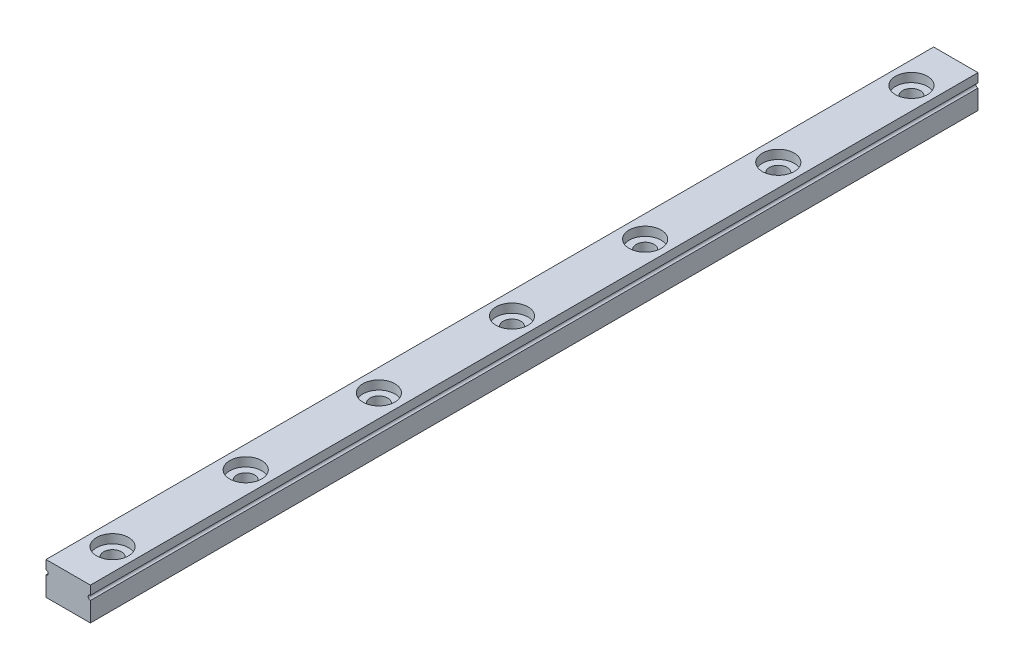
from build123d import *

# Parameters (mm, degrees)
BOSS_EXTRUDE1_DEPTH = 50
SKETCH2_R           = 1.8
CUT_EXTRUDE1_DEPTH  = 1
SKETCH3_R           = 1
CUT_EXTRUDE3_DEPTH  = 51.199003974
LPATTERN1_COUNT     = 7
LPATTERN1_PITCH     = 15
LPATTERN2_COUNT     = 7
LPATTERN2_PITCH     = 15


with BuildPart() as part:
    # Sketch1 → Boss-Extrude1 (new, symmetric)
    with BuildSketch(Plane.XY):
        with BuildLine():
            Line((-2.5, 3.7), (2.5, 3.7))
            Line((2.5, 3.7), (2.5, 2.7))
            ThreePointArc((2.5, 2.7), (2.25, 2.45), (2.5, 2.2))
            Line((2.5, 2.2), (2.5, 0))
            Line((2.5, 0), (-2.5, 0))
            Line((-2.5, 0), (-2.5, 2.2))
            ThreePointArc((-2.5, 2.2), (-2.25, 2.45), (-2.5, 2.7))
            Line((-2.5, 2.7), (-2.5, 3.7))
        make_face()
    extrude(amount=BOSS_EXTRUDE1_DEPTH, both=True)

    # Sketch2 → Cut-Extrude1 (cut)
    with BuildSketch(Plane(origin=(0, 3.7, 0), x_dir=(1, 0, 0), z_dir=(0, 1, 0))):
        with Locations(Location((0, 0, 0), (0, 0, 180))):
            Circle(SKETCH2_R)
    cut_extrude1 = extrude(amount=-CUT_EXTRUDE1_DEPTH, mode=Mode.SUBTRACT)

    # Sketch3 → Cut-Extrude3 (cut, through all)
    with BuildSketch(Plane(origin=(0, 3.7, 0), x_dir=(1, 0, 0), z_dir=(0, 1, 0))):
        with Locations(Location((0, 0, 0), (0, 0, 180))):
            Circle(SKETCH3_R)
    cut_extrude3 = extrude(amount=-CUT_EXTRUDE3_DEPTH, mode=Mode.SUBTRACT)

    # LPattern1: Cut-Extrude1, Cut-Extrude3 ×7
    with Locations(*[(0, 0, -i * LPATTERN1_PITCH) for i in range(1, LPATTERN1_COUNT)]):
        add(cut_extrude1, mode=Mode.SUBTRACT)
        add(cut_extrude3, mode=Mode.SUBTRACT)

    # LPattern2: Cut-Extrude1, Cut-Extrude3 ×7
    with Locations(*[(0, 0, i * LPATTERN2_PITCH) for i in range(1, LPATTERN2_COUNT)]):
        add(cut_extrude1, mode=Mode.SUBTRACT)
        add(cut_extrude3, mode=Mode.SUBTRACT)


solid = part.part
